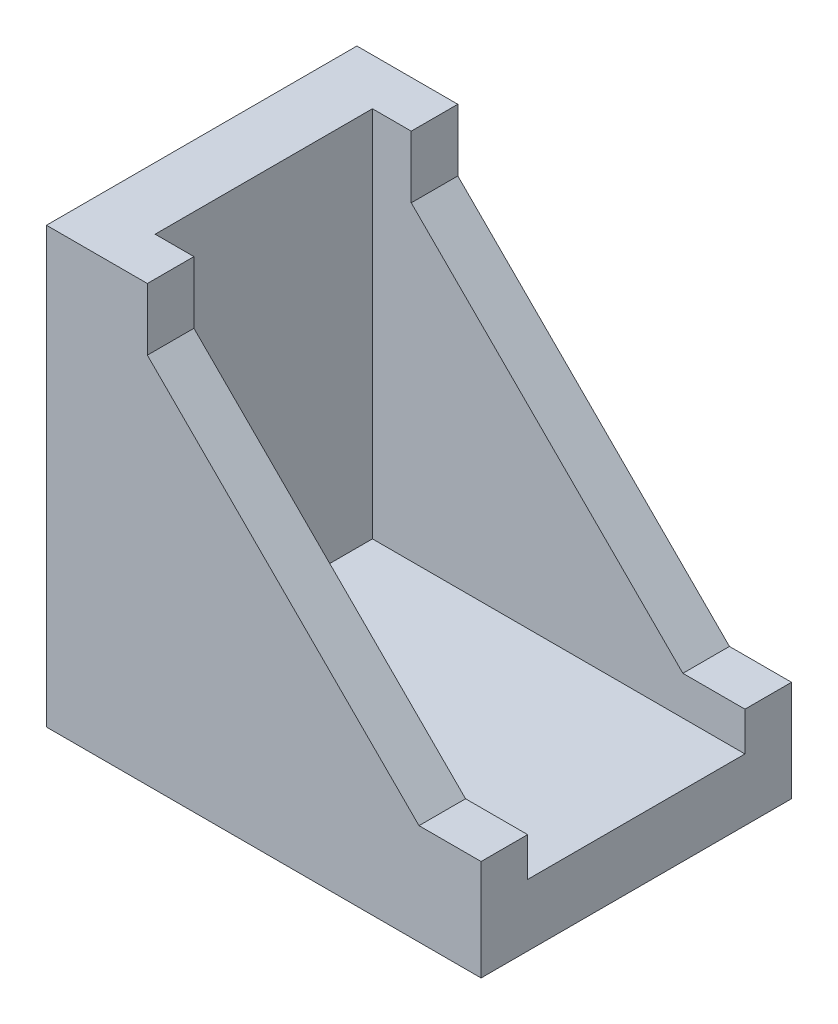
from build123d import *

# Parameters (mm, degrees)
EXTRUDE_1_DEPTH     = 20
CUT_EXTRUDE_START   = 3
SKETCH_2_W          = 25.638251078
SKETCH_2_H          = 25.026937626
CUT_EXTRUDE_1_DEPTH = 14


with BuildPart() as part:
    # 草图1 → 凸台-拉伸1 (new body)
    with BuildSketch(Plane.XY):
        Polygon((14, -7.5), (10, -7.5), (-7.5, 10), (-7.5, 14), (-14, 14), (-14, -14), (14, -14), align=None)
    extrude(amount=EXTRUDE_1_DEPTH)

    # 草图2 → 切除-拉伸1 (cut)
    with BuildSketch(Plane.XY.offset(CUT_EXTRUDE_START)):
        with Locations((2.819125539, 2.513468813)):
            Rectangle(SKETCH_2_W, SKETCH_2_H)
    extrude(amount=CUT_EXTRUDE_1_DEPTH, mode=Mode.SUBTRACT)


solid = part.part
